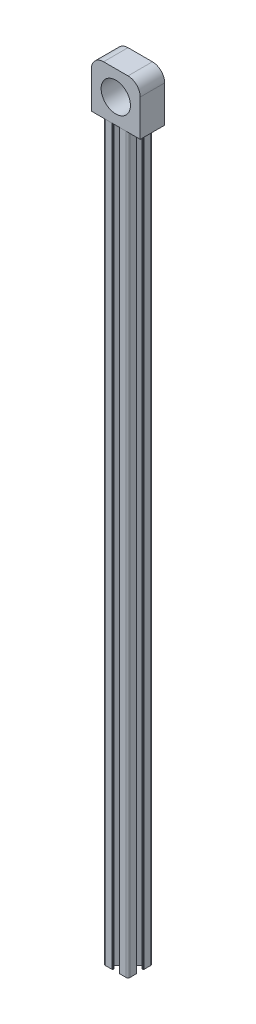
from build123d import *

# Parameters (mm, degrees)
BOSS_EXTRUDE1_DEPTH = 600
SKETCH2_W           = 40
SKETCH2_H           = 20
BOSS_EXTRUDE2_DEPTH = 40
FILLET1_R           = 10
SKETCH3_R           = 12
CUT_EXTRUDE1_DEPTH  = 40


with BuildPart() as part:
    # Sketch1 → Boss-Extrude1 (new body)
    with BuildSketch(Plane(origin=(0, 0, 0), x_dir=(1, 0, 0), z_dir=(0, 1, 0))):
        with BuildLine():
            Line((9.494919477, 2.658080263), (9.010919477, 2.658080263))
            ThreePointArc((9.010919477, 2.658080263), (8.651709233, 2.806870018), (8.502919477, 3.166080263))
            Line((8.502919477, 3.166080263), (8.502919477, 5.515080263))
            ThreePointArc((8.502919477, 5.515080263), (8.354129722, 5.874290508), (7.994919477, 6.023080263))
            Line((7.994919477, 6.023080263), (7.269000139, 6.023080263))
            ThreePointArc((7.269000139, 6.023080263), (7.074596955, 5.984411065), (6.909789894, 5.874290508))
            Line((6.909789894, 5.874290508), (3.806709233, 2.771209846))
            ThreePointArc((3.806709233, 2.771209846), (3.696588675, 2.606402785), (3.657919477, 2.411999602))
            Line((3.657919477, 2.411999602), (3.657919477, -2.355839076))
            ThreePointArc((3.657919477, -2.355839076), (3.696588675, -2.550242259), (3.806709233, -2.71504932))
            Line((3.806709233, -2.71504932), (6.909789894, -5.818129982))
            ThreePointArc((6.909789894, -5.818129982), (7.074596955, -5.92825054), (7.269000139, -5.966919737))
            Line((7.269000139, -5.966919737), (7.994919477, -5.966919737))
            ThreePointArc((7.994919477, -5.966919737), (8.354129722, -5.818129982), (8.502919477, -5.458919737))
            Line((8.502919477, -5.458919737), (8.502919477, -3.109919737))
            ThreePointArc((8.502919477, -3.109919737), (8.651709233, -2.750709492), (9.010919477, -2.601919737))
            Line((9.010919477, -2.601919737), (9.494919477, -2.601919737))
            ThreePointArc((9.494919477, -2.601919737), (9.854129722, -2.750709492), (10.002919477, -3.109919737))
            Line((10.002919477, -3.109919737), (10.002919477, -8.471919737))
            ThreePointArc((10.002919477, -8.471919737), (9.563579649, -9.532579909), (8.502919477, -9.971919737))
            Line((8.502919477, -9.971919737), (3.140919477, -9.971919737))
            ThreePointArc((3.140919477, -9.971919737), (2.781709233, -9.823129982), (2.632919477, -9.463919737))
            Line((2.632919477, -9.463919737), (2.632919477, -8.979919737))
            ThreePointArc((2.632919477, -8.979919737), (2.781709233, -8.620709492), (3.140919477, -8.471919737))
            Line((3.140919477, -8.471919737), (5.489919477, -8.471919737))
            ThreePointArc((5.489919477, -8.471919737), (5.849129722, -8.323129982), (5.997919477, -7.963919737))
            Line((5.997919477, -7.963919737), (5.997919477, -7.238000398))
            ThreePointArc((5.997919477, -7.238000398), (5.95925028, -7.043597215), (5.849129722, -6.878790154))
            Line((5.849129722, -6.878790154), (2.746049061, -3.775709492))
            ThreePointArc((2.746049061, -3.775709492), (2.581242, -3.665588935), (2.386838816, -3.626919737))
            Line((2.386838816, -3.626919737), (-2.380999861, -3.626919737))
            ThreePointArc((-2.380999861, -3.626919737), (-2.575403045, -3.665588935), (-2.740210106, -3.775709492))
            Line((-2.740210106, -3.775709492), (-5.843290767, -6.878790154))
            ThreePointArc((-5.843290767, -6.878790154), (-5.953411325, -7.043597215), (-5.992080523, -7.238000398))
            Line((-5.992080523, -7.238000398), (-5.992080523, -7.963919737))
            ThreePointArc((-5.992080523, -7.963919737), (-5.843290767, -8.323129982), (-5.484080523, -8.471919737))
            Line((-5.484080523, -8.471919737), (-3.135080523, -8.471919737))
            ThreePointArc((-3.135080523, -8.471919737), (-2.775870278, -8.620709492), (-2.627080523, -8.979919737))
            Line((-2.627080523, -8.979919737), (-2.627080523, -9.463919737))
            ThreePointArc((-2.627080523, -9.463919737), (-2.775870278, -9.823129982), (-3.135080523, -9.971919737))
            Line((-3.135080523, -9.971919737), (-8.497080523, -9.971919737))
            ThreePointArc((-8.497080523, -9.971919737), (-9.557740694, -9.532579909), (-9.997080523, -8.471919737))
            Line((-9.997080523, -8.471919737), (-9.997080523, -3.109919737))
            ThreePointArc((-9.997080523, -3.109919737), (-9.848290767, -2.750709492), (-9.489080523, -2.601919737))
            Line((-9.489080523, -2.601919737), (-9.005080523, -2.601919737))
            ThreePointArc((-9.005080523, -2.601919737), (-8.645870278, -2.750709492), (-8.497080523, -3.109919737))
            Line((-8.497080523, -3.109919737), (-8.497080523, -5.458919737))
            ThreePointArc((-8.497080523, -5.458919737), (-8.348290767, -5.818129982), (-7.989080523, -5.966919737))
            Line((-7.989080523, -5.966919737), (-7.263161184, -5.966919737))
            ThreePointArc((-7.263161184, -5.966919737), (-7.068758, -5.92825054), (-6.903950939, -5.818129982))
            Line((-6.903950939, -5.818129982), (-3.800870278, -2.71504932))
            ThreePointArc((-3.800870278, -2.71504932), (-3.69074972, -2.550242259), (-3.652080523, -2.355839076))
            Line((-3.652080523, -2.355839076), (-3.652080523, 2.411999602))
            ThreePointArc((-3.652080523, 2.411999602), (-3.69074972, 2.606402785), (-3.800870278, 2.771209846))
            Line((-3.800870278, 2.771209846), (-6.903950939, 5.874290508))
            ThreePointArc((-6.903950939, 5.874290508), (-7.068758, 5.984411065), (-7.263161184, 6.023080263))
            Line((-7.263161184, 6.023080263), (-7.989080523, 6.023080263))
            ThreePointArc((-7.989080523, 6.023080263), (-8.348290767, 5.874290508), (-8.497080523, 5.515080263))
            Line((-8.497080523, 5.515080263), (-8.497080523, 3.166080263))
            ThreePointArc((-8.497080523, 3.166080263), (-8.645870278, 2.806870018), (-9.005080523, 2.658080263))
            Line((-9.005080523, 2.658080263), (-9.489080523, 2.658080263))
            ThreePointArc((-9.489080523, 2.658080263), (-9.848290767, 2.806870018), (-9.997080523, 3.166080263))
            Line((-9.997080523, 3.166080263), (-9.997080523, 8.528080263))
            ThreePointArc((-9.997080523, 8.528080263), (-9.557740694, 9.588740435), (-8.497080523, 10.028080263))
            Line((-8.497080523, 10.028080263), (-3.135080523, 10.028080263))
            ThreePointArc((-3.135080523, 10.028080263), (-2.775870278, 9.879290508), (-2.627080523, 9.520080263))
            Line((-2.627080523, 9.520080263), (-2.627080523, 9.036080263))
            ThreePointArc((-2.627080523, 9.036080263), (-2.775870278, 8.676870018), (-3.135080523, 8.528080263))
            Line((-3.135080523, 8.528080263), (-5.484080523, 8.528080263))
            ThreePointArc((-5.484080523, 8.528080263), (-5.843290767, 8.379290508), (-5.992080523, 8.020080263))
            Line((-5.992080523, 8.020080263), (-5.992080523, 7.294160924))
            ThreePointArc((-5.992080523, 7.294160924), (-5.953411325, 7.099757741), (-5.843290767, 6.93495068))
            Line((-5.843290767, 6.93495068), (-2.740210106, 3.831870018))
            ThreePointArc((-2.740210106, 3.831870018), (-2.575403045, 3.72174946), (-2.380999861, 3.683080263))
            Line((-2.380999861, 3.683080263), (2.386838816, 3.683080263))
            ThreePointArc((2.386838816, 3.683080263), (2.581242, 3.72174946), (2.746049061, 3.831870018))
            Line((2.746049061, 3.831870018), (5.849129722, 6.93495068))
            ThreePointArc((5.849129722, 6.93495068), (5.95925028, 7.099757741), (5.997919477, 7.294160924))
            Line((5.997919477, 7.294160924), (5.997919477, 8.020080263))
            ThreePointArc((5.997919477, 8.020080263), (5.849129722, 8.379290508), (5.489919477, 8.528080263))
            Line((5.489919477, 8.528080263), (3.140919477, 8.528080263))
            ThreePointArc((3.140919477, 8.528080263), (2.781709233, 8.676870018), (2.632919477, 9.036080263))
            Line((2.632919477, 9.036080263), (2.632919477, 9.520080263))
            ThreePointArc((2.632919477, 9.520080263), (2.781709233, 9.879290508), (3.140919477, 10.028080263))
            Line((3.140919477, 10.028080263), (8.502919477, 10.028080263))
            ThreePointArc((8.502919477, 10.028080263), (9.563579649, 9.588740435), (10.002919477, 8.528080263))
            Line((10.002919477, 8.528080263), (10.002919477, 3.166080263))
            ThreePointArc((10.002919477, 3.166080263), (9.854129722, 2.806870018), (9.494919477, 2.658080263))
        make_face()
        with BuildLine():
            Line((2.127820321, -2.276425703), (2.307425444, -2.096820581))
            ThreePointArc((2.307425444, -2.096820581), (2.508857494, -1.328387548), (1.938052984, -0.775896455))
            ThreePointArc((1.938052984, -0.775896455), (2.098419477, 0.028080263), (1.938052984, 0.832056981))
            ThreePointArc((1.938052984, 0.832056981), (2.508857494, 1.384548074), (2.307425444, 2.152981107))
            Line((2.307425444, 2.152981107), (2.127820321, 2.332586229))
            ThreePointArc((2.127820321, 2.332586229), (1.359387288, 2.53401828), (0.806896195, 1.963213769))
            ThreePointArc((0.806896195, 1.963213769), (0.002919477, 2.123580263), (-0.801057241, 1.963213769))
            ThreePointArc((-0.801057241, 1.963213769), (-1.353548333, 2.53401828), (-2.121981366, 2.332586229))
            Line((-2.121981366, 2.332586229), (-2.301586489, 2.152981107))
            ThreePointArc((-2.301586489, 2.152981107), (-2.503018539, 1.384548074), (-1.932214029, 0.832056981))
            ThreePointArc((-1.932214029, 0.832056981), (-2.092580523, 0.028080263), (-1.932214029, -0.775896455))
            ThreePointArc((-1.932214029, -0.775896455), (-2.503018539, -1.328387548), (-2.301586489, -2.096820581))
            Line((-2.301586489, -2.096820581), (-2.121981366, -2.276425703))
            ThreePointArc((-2.121981366, -2.276425703), (-1.353548333, -2.477857754), (-0.801057241, -1.907053243))
            ThreePointArc((-0.801057241, -1.907053243), (0.002919477, -2.067419737), (0.806896195, -1.907053243))
            ThreePointArc((0.806896195, -1.907053243), (1.359387288, -2.477857754), (2.127820321, -2.276425703))
        make_face(mode=Mode.SUBTRACT)
    extrude(amount=BOSS_EXTRUDE1_DEPTH)

    # Sketch2 → Boss-Extrude2 (add)
    with BuildSketch(Plane(origin=(0, 600, 0), x_dir=(1, 0, 0), z_dir=(0, 1, 0))):
        Rectangle(SKETCH2_W, SKETCH2_H)
    extrude(amount=BOSS_EXTRUDE2_DEPTH)

    # Fillet1
    fillet1_edges = [part.edges().sort_by_distance(p)[0] for p in [
        (20, 640, 0),
        (-20, 640, 0),
    ]]
    fillet(fillet1_edges, radius=FILLET1_R)

    # Sketch3 → Cut-Extrude1 (cut)
    with BuildSketch(Plane.XY.offset(10)):
        with Locations((0, 620)):
            Circle(SKETCH3_R)
    extrude(amount=-CUT_EXTRUDE1_DEPTH, mode=Mode.SUBTRACT)


solid = part.part
